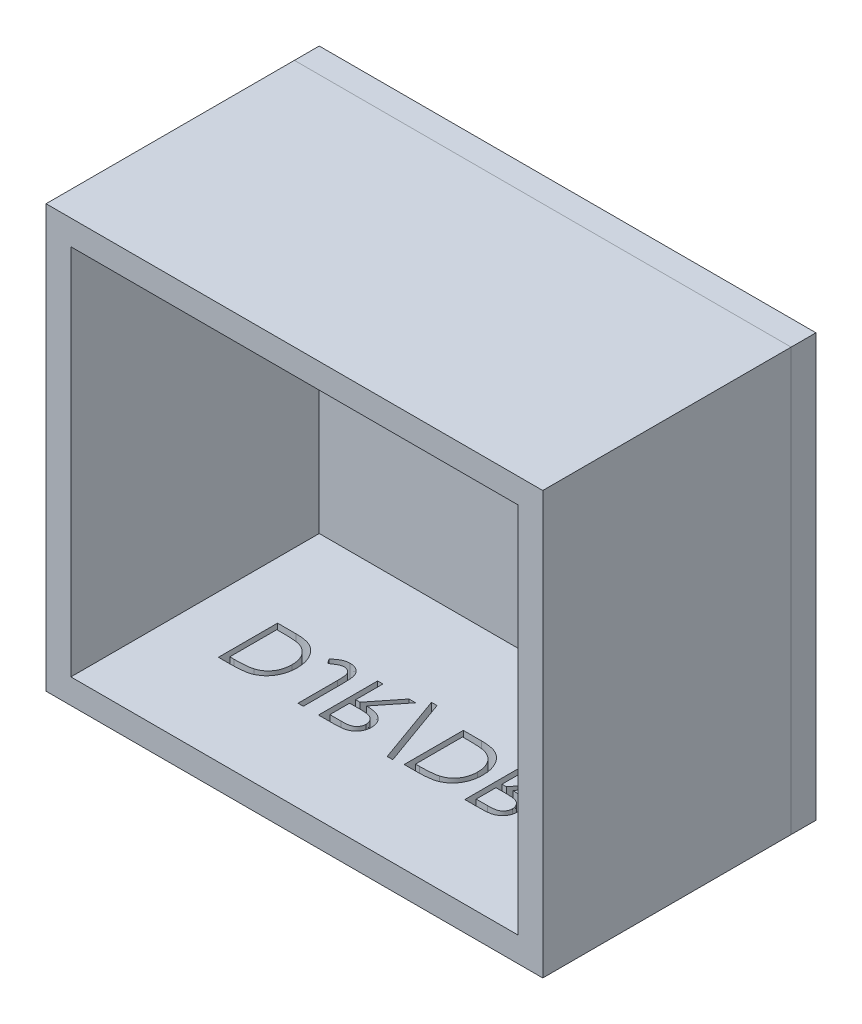
from build123d import *

# Parameters (mm, degrees)
CROQUIS1_W              = 200
CROQUIS1_H              = 170
CROQUIS1_W_2            = 180
CROQUIS1_H_2            = 150
SALIENTE_EXTRUIR1_DEPTH = 10
SALIENTE_EXTRUIR2_START = 10
CROQUIS1_3_W            = 200
CROQUIS1_3_H            = 170
CROQUIS1_3_W_2          = 180
CROQUIS1_3_H_2          = 150
SALIENTE_EXTRUIR2_DEPTH = 100
CORTAR_EXTRUIR3_DEPTH   = 100


with BuildPart() as part:
    # Croquis1 → Saliente-Extruir1 (new body)
    # profile 1 of 2: a face of its own
    with BuildSketch(Plane.XY):
        Rectangle(CROQUIS1_W, CROQUIS1_H)
        Rectangle(CROQUIS1_W_2, CROQUIS1_H_2, mode=Mode.SUBTRACT)
    # profile 2 of 2: a face of its own
    with BuildSketch(Plane.XY):
        Rectangle(CROQUIS1_W_2, CROQUIS1_H_2)
    extrude(amount=SALIENTE_EXTRUIR1_DEPTH)


with BuildPart() as body_2:
    # Croquis1<3> → Saliente-Extruir2 (new body)
    with BuildSketch(Plane.XY.offset(SALIENTE_EXTRUIR2_START)):
        Rectangle(CROQUIS1_3_W, CROQUIS1_3_H)
        Rectangle(CROQUIS1_3_W_2, CROQUIS1_3_H_2, mode=Mode.SUBTRACT)
    extrude(amount=SALIENTE_EXTRUIR2_DEPTH)

    # Croquis3 → Cortar-Extruir3 (cut)
    # profile 1 of 7: a face of its own
    with BuildSketch(Plane.XZ.offset(85)):
        with BuildLine():
            Line((-67.144529984, 49.640171629), (-67.144529984, 73.452671629))
            Line((-67.144529984, 73.452671629), (-62.336236715, 73.452671629))
            add(Edge.make_bspline(
                [(-62.336236715, 73.452671629), (-61.918028063, 73.449660572), (-61.110051124, 73.443843227), (-59.94247358, 73.406958405), (-58.86217691, 73.341708985), (-57.872714065, 73.246666317), (-56.971368676, 73.129964427), (-56.160664575, 72.98368489), (-55.436409817, 72.81095466), (-54.990983801, 72.663688293), (-54.780347292, 72.594047831)],
                knots=[0, 0, 0, 0, 1.314313732, 2.53924729, 3.670748893, 4.714932338, 5.66265055, 6.526160246, 7.303039223, 8, 8, 8, 8], degree=3))
            add(Edge.make_bspline(
                [(-54.780347292, 72.594047831), (-54.50483844, 72.489063923), (-53.960068364, 72.281476794), (-53.184412762, 71.889888386), (-52.454216989, 71.44620639), (-51.765565307, 70.949845967), (-51.134188256, 70.386752811), (-50.535420245, 69.780846568), (-49.993755784, 69.110093753), (-49.497718985, 68.388404995), (-49.05048173, 67.624281926), (-48.661731388, 66.819180561), (-48.338874755, 65.977189556), (-48.070860124, 65.100650425), (-47.859633333, 64.187635783), (-47.715520547, 63.237082515), (-47.62046792, 62.252747316), (-47.610915356, 61.58481034), (-47.606068445, 61.2459033)],
                knots=[0, 0, 0, 0, 0.984719456, 1.947108742, 2.898477687, 3.838006223, 4.779231079, 5.722358779, 6.681677486, 7.655904652, 8.64651281, 9.637519902, 10.640069247, 11.656948941, 12.698408672, 13.768548281, 14.867775369, 16, 16, 16, 16], degree=3))
            add(Edge.make_bspline(
                [(-47.606068445, 61.2459033), (-47.610347671, 60.951572374), (-47.618780331, 60.371562542), (-47.694499426, 59.516755734), (-47.804556175, 58.687308043), (-47.974946164, 57.887169263), (-48.181791836, 57.109329066), (-48.446887222, 56.362077546), (-48.750568009, 55.638559844), (-49.104693075, 54.948558802), (-49.49345857, 54.294848715), (-49.91066543, 53.67861164), (-50.355868661, 53.108640935), (-50.833313592, 52.583210556), (-51.336830377, 52.103112603), (-51.869715555, 51.66433657), (-52.433344168, 51.275467867), (-53.025191764, 50.921225577), (-53.662524, 50.612204944), (-54.357412661, 50.350743627), (-55.112821211, 50.134072905), (-55.926895454, 49.953295917), (-56.801041972, 49.809894983), (-57.736117793, 49.713785063), (-58.730686246, 49.648791003), (-59.413623747, 49.643100541), (-59.765135453, 49.640171629)],
                knots=[0, 0, 0, 0, 1.105936401, 2.179363191, 3.223086493, 4.248585256, 5.251745608, 6.245858792, 7.225916811, 8.198733463, 9.158002045, 10.082870192, 10.993790845, 11.873723703, 12.748670949, 13.606408763, 14.465103618, 15.319838547, 16.196477973, 17.123216899, 18.106603292, 19.147568657, 20.255746949, 21.433717677, 22.679120308, 24, 24, 24, 24], degree=3))
            Line((-59.765135453, 49.640171629), (-67.144529984, 49.640171629))
        make_face()
        with BuildLine():
            Line((-65.007510753, 52.082479321), (-62.274224996, 52.082479321))
            add(Edge.make_bspline(
                [(-62.274224996, 52.082479321), (-61.881465902, 52.084167263), (-61.126046327, 52.087413792), (-60.039801739, 52.115901728), (-59.047300845, 52.162451338), (-58.148402718, 52.227596064), (-57.343614892, 52.313787892), (-56.631255451, 52.409887677), (-56.013659497, 52.52961319), (-55.639943149, 52.638136682), (-55.46724633, 52.688286112)],
                knots=[0, 0, 0, 0, 1.375205317, 2.645023457, 3.804390687, 4.853969522, 5.800190428, 6.637939096, 7.370582563, 8, 8, 8, 8], degree=3))
            add(Edge.make_bspline(
                [(-55.46724633, 52.688286112), (-55.249883367, 52.764836892), (-54.82034915, 52.916110039), (-54.202033195, 53.192046984), (-53.62538286, 53.518904637), (-53.080348581, 53.882230822), (-52.574661871, 54.294840229), (-52.102329937, 54.747760706), (-51.664303753, 55.243297301), (-51.265108907, 55.780834972), (-50.90786491, 56.357028046), (-50.598498153, 56.966211896), (-50.327365411, 57.601711801), (-50.114559272, 58.273286613), (-49.947765744, 58.974932528), (-49.829623849, 59.706698908), (-49.756045099, 60.468449093), (-49.747462748, 60.98655551), (-49.743087676, 61.250673432)],
                knots=[0, 0, 0, 0, 0.998632004, 1.973411704, 2.929992603, 3.868527914, 4.809262121, 5.754881198, 6.702106254, 7.672490631, 8.653608572, 9.636854334, 10.631411391, 11.644891563, 12.686317036, 13.754757253, 14.855430412, 16, 16, 16, 16], degree=3))
            add(Edge.make_bspline(
                [(-49.743087676, 61.250673432), (-49.746579863, 61.529167289), (-49.753440296, 62.076270936), (-49.839670872, 62.879029059), (-49.965683598, 63.651102771), (-50.147908319, 64.392543707), (-50.380120192, 65.104798389), (-50.669915879, 65.783927557), (-51.0010227, 66.43710354), (-51.394972188, 67.049250564), (-51.826424707, 67.62818761), (-52.305245636, 68.158559446), (-52.823827719, 68.641574239), (-53.37651482, 69.084754206), (-53.978883299, 69.470269572), (-54.616743231, 69.815120027), (-55.299452172, 70.107781716), (-55.774427835, 70.263439693), (-56.015811534, 70.342545427)],
                knots=[0, 0, 0, 0, 1.122418816, 2.205001699, 3.251619955, 4.274784885, 5.280384055, 6.268708349, 7.249350384, 8.229342522, 9.199999885, 10.157847722, 11.105861043, 12.055065948, 13.010012805, 13.98527497, 14.976112212, 16, 16, 16, 16], degree=3))
            add(Edge.make_bspline(
                [(-56.015811534, 70.342545427), (-56.215504155, 70.397766124), (-56.640105457, 70.515180476), (-57.332977525, 70.643260243), (-58.112769881, 70.756230138), (-58.982944633, 70.851875013), (-59.942509864, 70.920504824), (-60.992203562, 70.972016804), (-62.132479443, 71.006760143), (-62.922935611, 71.009132597), (-63.333194347, 71.010363937)],
                knots=[0, 0, 0, 0, 0.674548936, 1.434276114, 2.292660221, 3.240891867, 4.284742987, 5.42552168, 6.663806718, 8, 8, 8, 8], degree=3))
            Line((-63.333194347, 71.010363937), (-65.007510753, 71.010363937))
            Line((-65.007510753, 71.010363937), (-65.007510753, 52.082479321))
        make_face(mode=Mode.SUBTRACT)
    # profile 2 of 7: a face of its own
    with BuildSketch(Plane.XZ.offset(85)):
        with BuildLine():
            Line((-35.089241522, 73.452671629), (-32.952222292, 73.452671629))
            Line((-32.952222292, 73.452671629), (-32.952222292, 57.372555944))
            add(Edge.make_bspline(
                [(-32.952222292, 57.372555944), (-32.954358059, 57.075204692), (-32.958458994, 56.504254004), (-32.981008823, 55.68187982), (-33.022738378, 54.930964972), (-33.083528374, 54.249801967), (-33.164628529, 53.64052476), (-33.257436238, 53.098425593), (-33.369782244, 52.628028826), (-33.538963024, 52.099831137), (-33.816371496, 51.52054918), (-34.233886523, 50.894925745), (-34.752541799, 50.34769129), (-35.353304185, 49.872443287), (-36.041424367, 49.493775339), (-36.802731893, 49.221937429), (-37.632540283, 49.056128565), (-38.208117067, 49.038616818), (-38.504656186, 49.029594706)],
                knots=[0, 0, 0, 0, 1.237770943, 2.376671248, 3.424123796, 4.367912054, 5.222547132, 5.982086412, 6.656319012, 7.234008312, 8.288027371, 9.317870876, 10.352700517, 11.413286737, 12.494591526, 13.606319346, 14.766767577, 16, 16, 16, 16], degree=3))
            add(Edge.make_bspline(
                [(-38.504656186, 49.029594706), (-38.735694302, 49.036946707), (-39.200558294, 49.051739421), (-39.892418294, 49.172310362), (-40.58231388, 49.358157014), (-41.273906773, 49.630317529), (-41.980860719, 50.000469904), (-42.71275047, 50.484780888), (-43.478990395, 51.082348952), (-43.98370168, 51.538445043), (-44.247895369, 51.77719086)],
                knots=[0, 0, 0, 0, 0.848567217, 1.707373443, 2.573483905, 3.470863513, 4.432650262, 5.500696352, 6.691726801, 8, 8, 8, 8], degree=3))
            Line((-44.247895369, 51.77719086), (-42.988580465, 53.608921629))
            add(Edge.make_bspline(
                [(-42.988580465, 53.608921629), (-42.698049738, 53.408574166), (-42.149489842, 53.030292031), (-41.343236414, 52.543655696), (-40.628880784, 52.126425552), (-40.161591446, 51.913798439), (-39.945236114, 51.815351917)],
                knots=[0, 0, 0, 0, 1.196737151, 2.259595785, 3.194191475, 4, 4, 4, 4], degree=3))
            add(Edge.make_bspline(
                [(-39.945236114, 51.815351917), (-39.814033923, 51.763920609), (-39.556717209, 51.663052362), (-39.163300149, 51.550481161), (-38.772128559, 51.488960479), (-38.512792106, 51.477521409), (-38.385402881, 51.471902398)],
                knots=[0, 0, 0, 0, 1.051806502, 2.062826769, 3.048436908, 4, 4, 4, 4], degree=3))
            add(Edge.make_bspline(
                [(-38.385402881, 51.471902398), (-38.220873552, 51.478860648), (-37.895659734, 51.492614543), (-37.423056489, 51.614053363), (-36.970904526, 51.799412605), (-36.555412748, 52.070815871), (-36.172471097, 52.39351893), (-35.856494015, 52.783744632), (-35.593078477, 53.216220344), (-35.434557349, 53.625601128), (-35.333559882, 53.998958202), (-35.269459171, 54.342083645), (-35.213406857, 54.743232275), (-35.164546655, 55.202882924), (-35.13594124, 55.721955841), (-35.103846937, 56.298926885), (-35.092245073, 56.935250716), (-35.090273256, 57.378918086), (-35.089241522, 57.611062554)],
                knots=[0, 0, 0, 0, 0.997221856, 1.971139923, 2.944579524, 3.951425367, 4.971190333, 5.972282193, 6.985401279, 8.033996657, 8.624075553, 9.332086008, 10.151144245, 11.082816738, 12.137127781, 13.306538797, 14.590673636, 16, 16, 16, 16], degree=3))
            Line((-35.089241522, 57.611062554), (-35.089241522, 73.452671629))
        make_face()
    # profile 3 of 7: a face of its own
    with BuildSketch(Plane.XZ.offset(85)):
        with BuildLine():
            Line((-26.846453061, 73.452671629), (-22.081090982, 73.452671629))
            add(Edge.make_bspline(
                [(-22.081090982, 73.452671629), (-21.763084375, 73.451613089), (-21.152476464, 73.449580574), (-20.277719035, 73.438247437), (-19.482877536, 73.405764767), (-18.768367558, 73.377811726), (-18.134202209, 73.326839768), (-17.578436891, 73.278121794), (-17.103631307, 73.214347423), (-16.81620864, 73.155119456), (-16.68607145, 73.128302639)],
                knots=[0, 0, 0, 0, 1.410062039, 2.707475311, 3.878576406, 4.937260626, 5.877586885, 6.699081471, 7.410979367, 8, 8, 8, 8], degree=3))
            add(Edge.make_bspline(
                [(-16.68607145, 73.128302639), (-16.511854954, 73.085258039), (-16.167138472, 73.000087097), (-15.670817487, 72.820067312), (-15.197871819, 72.611744509), (-14.75026605, 72.367062769), (-14.330242185, 72.084205786), (-13.933469391, 71.768056596), (-13.558147221, 71.420345071), (-13.219454344, 71.032304453), (-12.900101153, 70.625202485), (-12.630757105, 70.184985854), (-12.398575163, 69.724645818), (-12.213718609, 69.239500708), (-12.064870254, 68.734255439), (-11.959916733, 68.204333447), (-11.896975617, 67.652148956), (-11.890567635, 67.275517469), (-11.887318445, 67.084545127)],
                knots=[0, 0, 0, 0, 1.027469482, 2.033020251, 3.019912614, 3.986113645, 4.951240523, 5.91722682, 6.890402269, 7.87763091, 8.8651537, 9.85103654, 10.82876324, 11.815024772, 12.821070561, 13.842952187, 14.906261191, 16, 16, 16, 16], degree=3))
            add(Edge.make_bspline(
                [(-11.887318445, 67.084545127), (-11.897312879, 66.767259861), (-11.916814608, 66.14815413), (-12.098640759, 65.24966849), (-12.396477438, 64.411541189), (-12.806891244, 63.634827527), (-13.329538034, 62.934667601), (-13.957676345, 62.319689682), (-14.691656594, 61.805068134), (-15.374934619, 61.44820173), (-15.978508013, 61.219649977), (-16.475395374, 61.058838321), (-17.017415345, 60.934591736), (-17.599374711, 60.823284411), (-18.223695296, 60.739248776), (-18.888880742, 60.677699624), (-19.595405453, 60.6392319), (-20.080765907, 60.633503259), (-20.33045246, 60.630556244)],
                knots=[0, 0, 0, 0, 1.260483769, 2.459530307, 3.627416485, 4.787058657, 5.939039949, 7.08810263, 8.267026773, 9.491475466, 10.141966685, 10.831826277, 11.566392101, 12.351337768, 13.187381173, 14.07005841, 15.007169909, 16, 16, 16, 16], degree=3))
            Line((-20.33045246, 60.630556244), (-11.582029984, 49.640171629))
            Line((-11.582029984, 49.640171629), (-14.224683229, 49.640171629))
            Line((-14.224683229, 49.640171629), (-22.973105705, 60.630556244))
            Line((-22.973105705, 60.630556244), (-24.70943383, 60.630556244))
            Line((-24.70943383, 60.630556244), (-24.70943383, 49.640171629))
            Line((-24.70943383, 49.640171629), (-26.846453061, 49.640171629))
            Line((-26.846453061, 49.640171629), (-26.846453061, 73.452671629))
        make_face()
        with BuildLine():
            Line((-24.70943383, 71.010363937), (-24.70943383, 63.072863937))
            Line((-24.70943383, 63.072863937), (-20.349532989, 63.039473011))
            add(Edge.make_bspline(
                [(-20.349532989, 63.039473011), (-20.145969867, 63.039382955), (-19.751406559, 63.0392084), (-19.180582393, 63.066380341), (-18.649086633, 63.097291132), (-18.15895223, 63.1445715), (-17.709960226, 63.205504774), (-17.30233504, 63.281725078), (-16.935411276, 63.370525718), (-16.507476577, 63.507968922), (-16.029617319, 63.725724154), (-15.510290779, 64.04253585), (-15.068042732, 64.441015036), (-14.694405133, 64.896673728), (-14.394167393, 65.397663207), (-14.18249431, 65.937978147), (-14.048175193, 66.503978126), (-14.032332768, 66.892993467), (-14.024337676, 67.089315259)],
                knots=[0, 0, 0, 0, 1.146690395, 2.22261258, 3.21895312, 4.145990853, 4.996080663, 5.770904154, 6.481378293, 7.121626537, 8.300444488, 9.431385265, 10.535395872, 11.636531494, 12.74115979, 13.810798291, 14.895190096, 16, 16, 16, 16], degree=3))
            add(Edge.make_bspline(
                [(-14.024337676, 67.089315259), (-14.032516393, 67.280812484), (-14.048723625, 67.660290108), (-14.181044711, 68.215841926), (-14.404809966, 68.740172426), (-14.706359478, 69.231148654), (-15.073746586, 69.676821607), (-15.504533847, 70.058142416), (-15.986942407, 70.372803953), (-16.437823239, 70.573879291), (-16.840827434, 70.697159007), (-17.1907328, 70.783912461), (-17.586098389, 70.853611437), (-18.02884392, 70.909455566), (-18.517079301, 70.957454383), (-19.053273195, 70.989783448), (-19.633868075, 71.008927774), (-20.036278446, 71.009874075), (-20.24459008, 71.010363937)],
                knots=[0, 0, 0, 0, 1.101028733, 2.181837193, 3.264309656, 4.369019818, 5.486613113, 6.575447106, 7.666700264, 8.788928104, 9.402425223, 10.0903467, 10.862060571, 11.710948788, 12.657782767, 13.684531032, 14.801375019, 16, 16, 16, 16], degree=3))
            Line((-20.24459008, 71.010363937), (-24.70943383, 71.010363937))
        make_face(mode=Mode.SUBTRACT)
    # profile 4 of 7: a face of its own
    with BuildSketch(Plane.XZ.offset(85)):
        Polygon((3.682393093, 74.063248552), (-6.277642965, 46.281998552), (-8.529145369, 46.281998552), (1.430890689, 74.063248552), align=None)
    # profile 5 of 7: a face of its own
    with BuildSketch(Plane.XZ.offset(85)):
        with BuildLine():
            Line((7.651143093, 49.640171629), (7.651143093, 73.452671629))
            Line((7.651143093, 73.452671629), (12.459436362, 73.452671629))
            add(Edge.make_bspline(
                [(12.459436362, 73.452671629), (12.877645014, 73.449660572), (13.685621953, 73.443843227), (14.853199497, 73.406958405), (15.933496167, 73.341708985), (16.922959012, 73.246666317), (17.824304401, 73.129964427), (18.635008502, 72.98368489), (19.35926326, 72.81095466), (19.804689276, 72.663688293), (20.015325785, 72.594047831)],
                knots=[0, 0, 0, 0, 1.314313732, 2.53924729, 3.670748893, 4.714932338, 5.66265055, 6.526160246, 7.303039223, 8, 8, 8, 8], degree=3))
            add(Edge.make_bspline(
                [(20.015325785, 72.594047831), (20.290834637, 72.489063923), (20.835604713, 72.281476794), (21.611260314, 71.889888386), (22.341456088, 71.44620639), (23.03010777, 70.949845967), (23.661484821, 70.386752811), (24.260252832, 69.780846568), (24.801917293, 69.110093753), (25.297954092, 68.388404995), (25.745191347, 67.624281926), (26.133941689, 66.819180561), (26.456798322, 65.977189556), (26.724812953, 65.100650425), (26.936039744, 64.187635783), (27.08015253, 63.237082515), (27.175205157, 62.252747316), (27.184757721, 61.58481034), (27.189604631, 61.2459033)],
                knots=[0, 0, 0, 0, 0.984719456, 1.947108742, 2.898477687, 3.838006223, 4.779231079, 5.722358779, 6.681677486, 7.655904652, 8.64651281, 9.637519902, 10.640069247, 11.656948941, 12.698408672, 13.768548281, 14.867775369, 16, 16, 16, 16], degree=3))
            add(Edge.make_bspline(
                [(27.189604631, 61.2459033), (27.185325406, 60.951572374), (27.176892746, 60.371562542), (27.101173651, 59.516755734), (26.991116902, 58.687308043), (26.820726913, 57.887169263), (26.613881241, 57.109329066), (26.348785855, 56.362077546), (26.045105068, 55.638559844), (25.690980002, 54.948558802), (25.302214507, 54.294848715), (24.885007647, 53.67861164), (24.439804416, 53.108640935), (23.962359485, 52.583210556), (23.4588427, 52.103112603), (22.925957522, 51.66433657), (22.362328909, 51.275467867), (21.770481313, 50.921225577), (21.133149077, 50.612204944), (20.438260416, 50.350743627), (19.682851866, 50.134072905), (18.868777623, 49.953295917), (17.994631105, 49.809894983), (17.059555284, 49.713785063), (16.064986831, 49.648791003), (15.38204933, 49.643100541), (15.030537624, 49.640171629)],
                knots=[0, 0, 0, 0, 1.105936401, 2.179363191, 3.223086493, 4.248585256, 5.251745608, 6.245858792, 7.225916811, 8.198733463, 9.158002045, 10.082870192, 10.993790845, 11.873723703, 12.748670949, 13.606408763, 14.465103618, 15.319838547, 16.196477973, 17.123216899, 18.106603292, 19.147568657, 20.255746949, 21.433717677, 22.679120308, 24, 24, 24, 24], degree=3))
            Line((15.030537624, 49.640171629), (7.651143093, 49.640171629))
        make_face()
        with BuildLine():
            Line((9.788162324, 52.082479321), (12.521448081, 52.082479321))
            add(Edge.make_bspline(
                [(12.521448081, 52.082479321), (12.914207175, 52.084167263), (13.66962675, 52.087413792), (14.755871338, 52.115901728), (15.748372232, 52.162451338), (16.647270359, 52.227596064), (17.452058185, 52.313787892), (18.164417626, 52.409887677), (18.78201358, 52.52961319), (19.155729928, 52.638136682), (19.328426747, 52.688286112)],
                knots=[0, 0, 0, 0, 1.375205317, 2.645023457, 3.804390687, 4.853969522, 5.800190428, 6.637939096, 7.370582563, 8, 8, 8, 8], degree=3))
            add(Edge.make_bspline(
                [(19.328426747, 52.688286112), (19.54578971, 52.764836892), (19.975323927, 52.916110039), (20.593639882, 53.192046984), (21.170290217, 53.518904637), (21.715324496, 53.882230822), (22.221011206, 54.294840229), (22.69334314, 54.747760706), (23.131369324, 55.243297301), (23.530564169, 55.780834972), (23.887808167, 56.357028046), (24.197174924, 56.966211896), (24.468307665, 57.601711801), (24.681113805, 58.273286613), (24.847907333, 58.974932528), (24.966049227, 59.706698908), (25.039627978, 60.468449093), (25.048210329, 60.98655551), (25.052585401, 61.250673432)],
                knots=[0, 0, 0, 0, 0.998632004, 1.973411704, 2.929992603, 3.868527914, 4.809262121, 5.754881198, 6.702106254, 7.672490631, 8.653608572, 9.636854334, 10.631411391, 11.644891563, 12.686317036, 13.754757253, 14.855430412, 16, 16, 16, 16], degree=3))
            add(Edge.make_bspline(
                [(25.052585401, 61.250673432), (25.049093213, 61.529167289), (25.042232781, 62.076270936), (24.956002204, 62.879029059), (24.829989479, 63.651102771), (24.647764758, 64.392543707), (24.415552885, 65.104798389), (24.125757198, 65.783927557), (23.794650377, 66.43710354), (23.400700889, 67.049250564), (22.96924837, 67.62818761), (22.490427441, 68.158559446), (21.971845357, 68.641574239), (21.419158257, 69.084754206), (20.816789778, 69.470269572), (20.178929846, 69.815120027), (19.496220904, 70.107781716), (19.021245242, 70.263439693), (18.779861543, 70.342545427)],
                knots=[0, 0, 0, 0, 1.122418816, 2.205001699, 3.251619955, 4.274784885, 5.280384055, 6.268708349, 7.249350384, 8.229342522, 9.199999885, 10.157847722, 11.105861043, 12.055065948, 13.010012805, 13.98527497, 14.976112212, 16, 16, 16, 16], degree=3))
            add(Edge.make_bspline(
                [(18.779861543, 70.342545427), (18.580168922, 70.397766124), (18.15556762, 70.515180476), (17.462695552, 70.643260243), (16.682903196, 70.756230138), (15.812728444, 70.851875013), (14.853163213, 70.920504824), (13.803469515, 70.972016804), (12.663193634, 71.006760143), (11.872737466, 71.009132597), (11.46247873, 71.010363937)],
                knots=[0, 0, 0, 0, 0.674548936, 1.434276114, 2.292660221, 3.240891867, 4.284742987, 5.42552168, 6.663806718, 8, 8, 8, 8], degree=3))
            Line((11.46247873, 71.010363937), (9.788162324, 71.010363937))
            Line((9.788162324, 71.010363937), (9.788162324, 52.082479321))
        make_face(mode=Mode.SUBTRACT)
    # profile 6 of 7: a face of its own
    with BuildSketch(Plane.XZ.offset(85)):
        with BuildLine():
            Line((32.074220016, 73.452671629), (36.839582095, 73.452671629))
            add(Edge.make_bspline(
                [(36.839582095, 73.452671629), (37.157588702, 73.451613089), (37.768196613, 73.449580574), (38.642954042, 73.438247437), (39.437795541, 73.405764767), (40.152305519, 73.377811726), (40.786470868, 73.326839768), (41.342236186, 73.278121794), (41.81704177, 73.214347423), (42.104464437, 73.155119456), (42.234601627, 73.128302639)],
                knots=[0, 0, 0, 0, 1.410062039, 2.707475311, 3.878576406, 4.937260626, 5.877586885, 6.699081471, 7.410979367, 8, 8, 8, 8], degree=3))
            add(Edge.make_bspline(
                [(42.234601627, 73.128302639), (42.408818123, 73.085258039), (42.753534605, 73.000087097), (43.24985559, 72.820067312), (43.722801258, 72.611744509), (44.170407027, 72.367062769), (44.590430892, 72.084205786), (44.987203685, 71.768056596), (45.362525856, 71.420345071), (45.701218733, 71.032304453), (46.020571924, 70.625202485), (46.289915972, 70.184985854), (46.522097914, 69.724645818), (46.706954467, 69.239500708), (46.855802823, 68.734255439), (46.960756344, 68.204333447), (47.02369746, 67.652148956), (47.030105442, 67.275517469), (47.033354631, 67.084545127)],
                knots=[0, 0, 0, 0, 1.027469482, 2.033020251, 3.019912614, 3.986113645, 4.951240523, 5.91722682, 6.890402269, 7.87763091, 8.8651537, 9.85103654, 10.82876324, 11.815024772, 12.821070561, 13.842952187, 14.906261191, 16, 16, 16, 16], degree=3))
            add(Edge.make_bspline(
                [(47.033354631, 67.084545127), (47.023360198, 66.767259861), (47.003858469, 66.14815413), (46.822032318, 65.24966849), (46.524195639, 64.411541189), (46.113781833, 63.634827527), (45.591135043, 62.934667601), (44.962996732, 62.319689682), (44.229016483, 61.805068134), (43.545738458, 61.44820173), (42.942165064, 61.219649977), (42.445277703, 61.058838321), (41.903257732, 60.934591736), (41.321298366, 60.823284411), (40.696977781, 60.739248776), (40.031792334, 60.677699624), (39.325267624, 60.6392319), (38.83990717, 60.633503259), (38.590220617, 60.630556244)],
                knots=[0, 0, 0, 0, 1.260483769, 2.459530307, 3.627416485, 4.787058657, 5.939039949, 7.08810263, 8.267026773, 9.491475466, 10.141966685, 10.831826277, 11.566392101, 12.351337768, 13.187381173, 14.07005841, 15.007169909, 16, 16, 16, 16], degree=3))
            Line((38.590220617, 60.630556244), (47.338643093, 49.640171629))
            Line((47.338643093, 49.640171629), (44.695989848, 49.640171629))
            Line((44.695989848, 49.640171629), (35.947567372, 60.630556244))
            Line((35.947567372, 60.630556244), (34.211239247, 60.630556244))
            Line((34.211239247, 60.630556244), (34.211239247, 49.640171629))
            Line((34.211239247, 49.640171629), (32.074220016, 49.640171629))
            Line((32.074220016, 49.640171629), (32.074220016, 73.452671629))
        make_face()
        with BuildLine():
            Line((34.211239247, 71.010363937), (34.211239247, 63.072863937))
            Line((34.211239247, 63.072863937), (38.571140088, 63.039473011))
            add(Edge.make_bspline(
                [(38.571140088, 63.039473011), (38.77470321, 63.039382955), (39.169266518, 63.0392084), (39.740090684, 63.066380341), (40.271586444, 63.097291132), (40.761720847, 63.1445715), (41.210712851, 63.205504774), (41.618338037, 63.281725078), (41.985261801, 63.370525718), (42.4131965, 63.507968922), (42.891055758, 63.725724154), (43.410382298, 64.04253585), (43.852630345, 64.441015036), (44.226267944, 64.896673728), (44.526505683, 65.397663207), (44.738178767, 65.937978147), (44.872497884, 66.503978126), (44.888340309, 66.892993467), (44.896335401, 67.089315259)],
                knots=[0, 0, 0, 0, 1.146690395, 2.22261258, 3.21895312, 4.145990853, 4.996080663, 5.770904154, 6.481378293, 7.121626537, 8.300444488, 9.431385265, 10.535395872, 11.636531494, 12.74115979, 13.810798291, 14.895190096, 16, 16, 16, 16], degree=3))
            add(Edge.make_bspline(
                [(44.896335401, 67.089315259), (44.888156684, 67.280812484), (44.871949452, 67.660290108), (44.739628366, 68.215841926), (44.515863111, 68.740172426), (44.214313599, 69.231148654), (43.846926491, 69.676821607), (43.41613923, 70.058142416), (42.93373067, 70.372803953), (42.482849838, 70.573879291), (42.079845643, 70.697159007), (41.729940277, 70.783912461), (41.334574688, 70.853611437), (40.891829157, 70.909455566), (40.403593776, 70.957454383), (39.867399882, 70.989783448), (39.286805002, 71.008927774), (38.884394631, 71.009874075), (38.676082997, 71.010363937)],
                knots=[0, 0, 0, 0, 1.101028733, 2.181837193, 3.264309656, 4.369019818, 5.486613113, 6.575447106, 7.666700264, 8.788928104, 9.402425223, 10.0903467, 10.862060571, 11.710948788, 12.657782767, 13.684531032, 14.801375019, 16, 16, 16, 16], degree=3))
            Line((38.676082997, 71.010363937), (34.211239247, 71.010363937))
        make_face(mode=Mode.SUBTRACT)
    # profile 7 of 7: a face of its own
    with BuildSketch(Plane.XZ.offset(85)):
        with BuildLine():
            Line((59.855470016, 73.452671629), (61.992489247, 73.452671629))
            Line((61.992489247, 73.452671629), (61.992489247, 57.372555944))
            add(Edge.make_bspline(
                [(61.992489247, 57.372555944), (61.990353479, 57.075204692), (61.986252544, 56.504254004), (61.963702715, 55.68187982), (61.92197316, 54.930964972), (61.861183165, 54.249801967), (61.780083009, 53.64052476), (61.6872753, 53.098425593), (61.574929294, 52.628028826), (61.405748514, 52.099831137), (61.128340043, 51.52054918), (60.710825015, 50.894925745), (60.19216974, 50.34769129), (59.591407353, 49.872443287), (58.903287172, 49.493775339), (58.141979645, 49.221937429), (57.312171255, 49.056128565), (56.736594471, 49.038616818), (56.440055353, 49.029594706)],
                knots=[0, 0, 0, 0, 1.237770943, 2.376671248, 3.424123796, 4.367912054, 5.222547132, 5.982086412, 6.656319012, 7.234008312, 8.288027371, 9.317870876, 10.352700517, 11.413286737, 12.494591526, 13.606319346, 14.766767577, 16, 16, 16, 16], degree=3))
            add(Edge.make_bspline(
                [(56.440055353, 49.029594706), (56.209017237, 49.036946707), (55.744153245, 49.051739421), (55.052293244, 49.172310362), (54.362397658, 49.358157014), (53.670804765, 49.630317529), (52.96385082, 50.000469904), (52.231961068, 50.484780888), (51.465721144, 51.082348952), (50.961009858, 51.538445043), (50.69681617, 51.77719086)],
                knots=[0, 0, 0, 0, 0.848567217, 1.707373443, 2.573483905, 3.470863513, 4.432650262, 5.500696352, 6.691726801, 8, 8, 8, 8], degree=3))
            Line((50.69681617, 51.77719086), (51.956131074, 53.608921629))
            add(Edge.make_bspline(
                [(51.956131074, 53.608921629), (52.246661801, 53.408574166), (52.795221696, 53.030292031), (53.601475124, 52.543655696), (54.315830754, 52.126425552), (54.783120092, 51.913798439), (54.999475425, 51.815351917)],
                knots=[0, 0, 0, 0, 1.196737151, 2.259595785, 3.194191475, 4, 4, 4, 4], degree=3))
            add(Edge.make_bspline(
                [(54.999475425, 51.815351917), (55.130677616, 51.763920609), (55.387994329, 51.663052362), (55.781411389, 51.550481161), (56.17258298, 51.488960479), (56.431919433, 51.477521409), (56.559308658, 51.471902398)],
                knots=[0, 0, 0, 0, 1.051806502, 2.062826769, 3.048436908, 4, 4, 4, 4], degree=3))
            add(Edge.make_bspline(
                [(56.559308658, 51.471902398), (56.723837986, 51.478860648), (57.049051805, 51.492614543), (57.52165505, 51.614053363), (57.973807012, 51.799412605), (58.38929879, 52.070815871), (58.772240442, 52.39351893), (59.088217523, 52.783744632), (59.351633061, 53.216220344), (59.510154189, 53.625601128), (59.611151656, 53.998958202), (59.675252367, 54.342083645), (59.731304682, 54.743232275), (59.780164883, 55.202882924), (59.808770299, 55.721955841), (59.840864602, 56.298926885), (59.852466466, 56.935250716), (59.854438283, 57.378918086), (59.855470016, 57.611062554)],
                knots=[0, 0, 0, 0, 0.997221856, 1.971139923, 2.944579524, 3.951425367, 4.971190333, 5.972282193, 6.985401279, 8.033996657, 8.624075553, 9.332086008, 10.151144245, 11.082816738, 12.137127781, 13.306538797, 14.590673636, 16, 16, 16, 16], degree=3))
            Line((59.855470016, 57.611062554), (59.855470016, 73.452671629))
        make_face()
    extrude(amount=-CORTAR_EXTRUIR3_DEPTH, mode=Mode.SUBTRACT)


with BuildPart() as cortar_extruir3_piece_1:
    # of the separate pieces the step leaves, piece 1, a body of its own (cortar_extruir3_pieces)
    add(body_2.part.solids().sort_by_distance((-100, 85, 10))[0])


with BuildPart() as cortar_extruir3_piece_2:
    # of the separate pieces the step leaves, piece 2, a body of its own (cortar_extruir3_pieces)
    add(body_2.part.solids().sort_by_distance((-65.007510753, -85, 71.010363937))[0])


with BuildPart() as cortar_extruir3_piece_3:
    # of the separate pieces the step leaves, piece 3, a body of its own (cortar_extruir3_pieces)
    add(body_2.part.solids().sort_by_distance((9.788162324, -85, 71.010363937))[0])


with BuildPart() as cortar_extruir3_piece_4:
    # of the separate pieces the step leaves, piece 4, a body of its own (cortar_extruir3_pieces)
    add(body_2.part.solids().sort_by_distance((38.676082997, -85, 71.010363937))[0])


with BuildPart() as cortar_extruir3_piece_5:
    # of the separate pieces the step leaves, piece 5, a body of its own (cortar_extruir3_pieces)
    add(body_2.part.solids().sort_by_distance((-20.24459008, -85, 71.010363937))[0])


solid = Compound([part.part, cortar_extruir3_piece_1.part, cortar_extruir3_piece_2.part, cortar_extruir3_piece_3.part, cortar_extruir3_piece_4.part, cortar_extruir3_piece_5.part])
